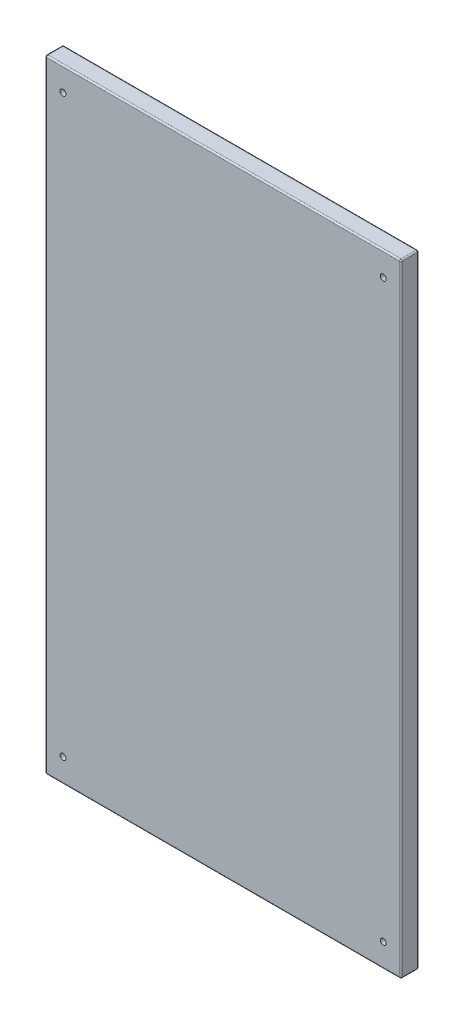
from build123d import *

# Parameters (mm, degrees)
SKETCH1_W           = 120
SKETCH1_H           = 210
BOSS_EXTRUDE1_DEPTH = 6
SKETCH2_R           = 2
CUT_EXTRUDE1_DEPTH  = 3
SKETCH3_R           = 1
CUT_EXTRUDE2_DEPTH  = 3
FILLET1_R           = 0.5


with BuildPart() as part:
    # Sketch1 → Boss-Extrude1 (new body)
    with BuildSketch(Plane.XY):
        with Locations((-60, 0)):
            Rectangle(SKETCH1_W, SKETCH1_H)
    extrude(amount=BOSS_EXTRUDE1_DEPTH)

    # Sketch2 → Cut-Extrude1 (cut)
    with BuildSketch(Plane(origin=(0, 0, 0), x_dir=(-1, 0, 0), z_dir=(0, 0, -1))):
        with Locations((6, 97)):
            Circle(SKETCH2_R)
        with Locations((114, 97)):
            Circle(SKETCH2_R)
        with Locations((6, -97)):
            Circle(SKETCH2_R)
        with Locations((114, -97)):
            Circle(SKETCH2_R)
    extrude(amount=-CUT_EXTRUDE1_DEPTH, mode=Mode.SUBTRACT)

    # Sketch3 → Cut-Extrude2 (cut)
    with BuildSketch(Plane.XY.offset(6)):
        with Locations((-114, 97)):
            Circle(SKETCH3_R)
        with Locations((-6, 97)):
            Circle(SKETCH3_R)
        with Locations((-6, -97)):
            Circle(SKETCH3_R)
        with Locations((-114, -97)):
            Circle(SKETCH3_R)
    extrude(amount=-CUT_EXTRUDE2_DEPTH, mode=Mode.SUBTRACT)

    # Fillet1
    fillet1_edges = [part.edges().sort_by_distance(p)[0] for p in [
        (0, 0, 6),
        (-60, 105, 6),
        (-120, 0, 6),
        (-60, 105, 0),
        (0, 0, 0),
        (-60, -105, 0),
        (-120, 0, 0),
        (-120, 105, 3),
        (0, 105, 3),
        (0, -105, 3),
        (-120, -105, 3),
        (-60, -105, 6),
    ]]
    fillet(fillet1_edges, radius=FILLET1_R)


solid = part.part
